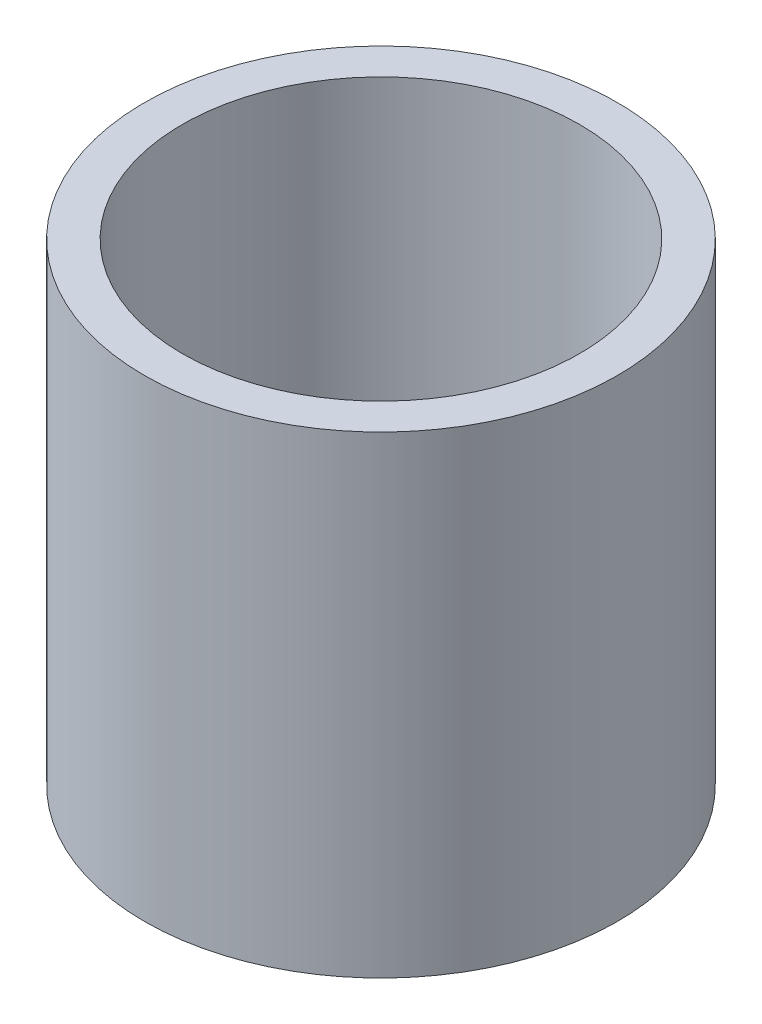
from build123d import *

# Parameters (mm, degrees)
SKETCH1_R           = 12.5
BOSS_EXTRUDE1_DEPTH = 25
SHELL1_T            = -2
SKETCH2_R           = 3
CUT_EXTRUDE1_DEPTH  = 25


with BuildPart() as part:
    # Sketch1 → Boss-Extrude1 (new body)
    with BuildSketch(Plane(origin=(0, 0, 0), x_dir=(1, 0, 0), z_dir=(0, 1, 0))):
        with Locations(Location((0.866701165, -1.191714102, 0), (0, 0, 270))):
            Circle(SKETCH1_R)
    extrude(amount=BOSS_EXTRUDE1_DEPTH)

    # Shell1
    shell1_openings = [part.faces().sort_by_distance(p)[0] for p in [
        (0.866701165, 25, 1.191714102),
    ]]
    offset(amount=SHELL1_T, openings=shell1_openings, kind=Kind.INTERSECTION)

    # Sketch2 → Cut-Extrude1 (cut)
    with BuildSketch(Plane(origin=(0, 2, 0), x_dir=(1, 0, 0), z_dir=(0, 1, 0))):
        with Locations(Location((0.866701165, -1.191714102, 0), (0, 0, 270))):
            Circle(SKETCH2_R)
    extrude(amount=-CUT_EXTRUDE1_DEPTH, mode=Mode.SUBTRACT)


solid = part.part
